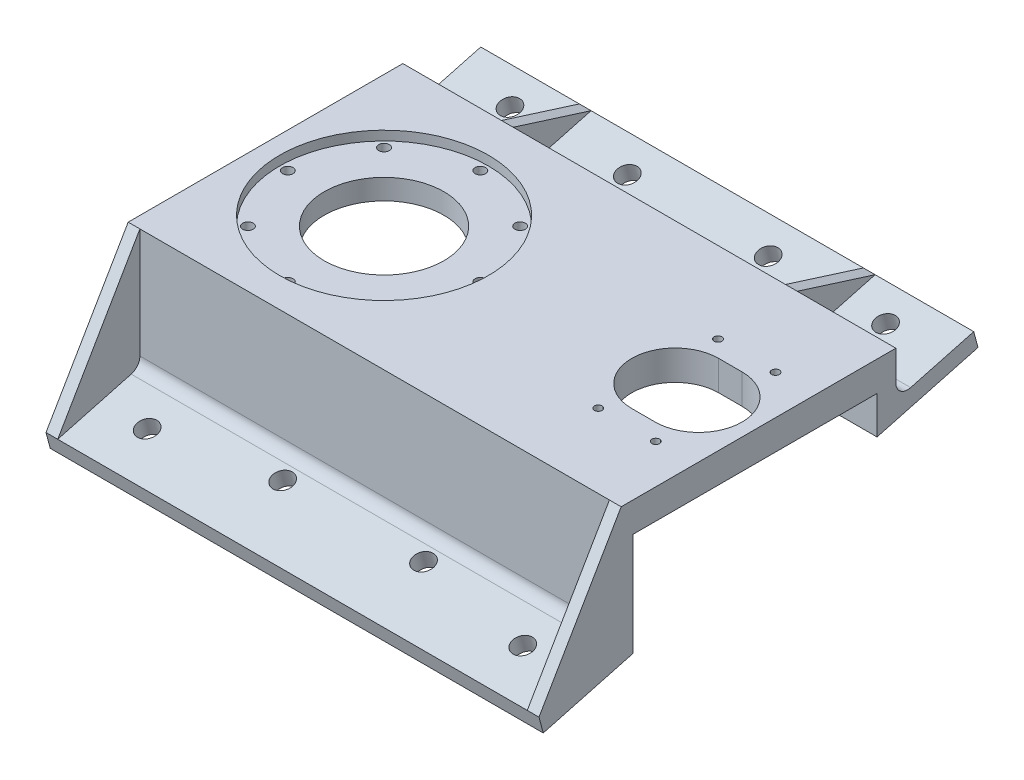
from build123d import *

# Parameters (mm, degrees)
EXTRUDE_1_DEPTH      = 30
SKETCH_2_R           = 44.45
CUT_EXTRUDE_1_DEPTH  = 4
SKETCH_3_R           = 25.5
SKETCH_3_R_2         = 2.25
CUT_EXTRUDE_2_DEPTH  = 188.619295383
CUT_EXTRUDE_3_DEPTH  = 189.215302247
SKETCH_5_R           = 1.65
CUT_EXTRUDE_4_DEPTH  = 189.215302247
EXTRUDE_START        = -30
EXTRUDE_2_DEPTH      = 30
CUT_EXTRUDE_5_DEPTH  = 198.040604952
CUT_EXTRUDE_7_DEPTH  = 233.432785983
CUT_EXTRUDE_8_DEPTH  = 233.432785983
CUT_EXTRUDE_9_DEPTH  = 233.432785983
FILLET_1_R           = 5
CUT_EXTRUDE_10_DEPTH = 233.432785983
EXTRUDE_START_2      = -5
EXTRUDE_3_DEPTH      = 5
EXTRUDE_4_DEPTH      = 5
SKETCH_14_R          = 4.25
CUT_EXTRUDE_11_DEPTH = 189.364728478
SKETCH_16_W          = 43
SKETCH_16_H          = 30
CUT_EXTRUDE_12_DEPTH = 233.432785983
EXTRUDE_7_REACH      = 188.592
SKETCH_18_W          = 210
SKETCH_18_H          = 5
EXTRUDE_8_DEPTH      = 210
EXTRUDE_9_DEPTH      = 5
EXTRUDE_10_DEPTH     = 5
SKETCH_22_R          = 4.25
CUT_EXTRUDE_13_DEPTH = 187.984035343
FILLET_2_R           = 5
EXTRUDE_11_DEPTH     = 2.5
CUT_EXTRUDE_START    = -5
CUT_EXTRUDE_16_DEPTH = 5
EXTRUDE_12_DEPTH     = 2.5
CUT_EXTRUDE_18_DEPTH = 5


with BuildPart() as part:
    # 草图1 → 凸台-拉伸1 (new body)
    with BuildSketch(Plane(origin=(0, 0, 0), x_dir=(1, 0, 0), z_dir=(0, 1, 0))):
        with BuildLine():
            Line((170, 31.93), (170, -31.93))
            ThreePointArc((170, -31.93), (167.781993847, -38.210172909), (162.111885646, -41.704453387))
            Line((162.111885646, -41.704453387), (15.839142344, -73.308400404))
            ThreePointArc((15.839142344, -73.308400404), (-75, 0), (15.839142344, 73.308400404))
            Line((15.839142344, 73.308400404), (162.111885646, 41.704453387))
            ThreePointArc((162.111885646, 41.704453387), (167.781993847, 38.210172909), (170, 31.93))
        make_face()
    extrude(amount=EXTRUDE_1_DEPTH)

    # 草图2 → 切除-拉伸1 (cut)
    with BuildSketch(Plane(origin=(0, 30, 0), x_dir=(1, 0, 0), z_dir=(0, 1, 0))):
        with Locations(Location((0, 0, 0), (0, 0, 270))):
            Circle(SKETCH_2_R)
    extrude(amount=-CUT_EXTRUDE_1_DEPTH, mode=Mode.SUBTRACT)

    # 草图3 → 切除-拉伸2 (cut, through all)
    with BuildSketch(Plane(origin=(0, 26, 0), x_dir=(1, 0, 0), z_dir=(0, 1, 0))):
        with Locations(Location((0, 0, 0), (0, 0, 270))):
            Circle(SKETCH_3_R)
        with Locations(Location((0, 41, 0), (0, 0, 270))):
            Circle(SKETCH_3_R_2)
        with Locations(Location((28.991378029, 28.991378029, 0), (0, 0, 270))):
            Circle(SKETCH_3_R_2)
        with Locations(Location((41, 0, 0), (0, 0, 270))):
            Circle(SKETCH_3_R_2)
        with Locations(Location((28.991378029, -28.991378029, 0), (0, 0, 270))):
            Circle(SKETCH_3_R_2)
        with Locations(Location((0, -41, 0), (0, 0, 270))):
            Circle(SKETCH_3_R_2)
        with Locations(Location((-28.991378029, -28.991378029, 0), (0, 0, 270))):
            Circle(SKETCH_3_R_2)
        with Locations(Location((-41, 0, 0), (0, 0, 270))):
            Circle(SKETCH_3_R_2)
        with Locations(Location((-28.991378029, 28.991378029, 0), (0, 0, 270))):
            Circle(SKETCH_3_R_2)
    extrude(amount=-CUT_EXTRUDE_2_DEPTH, mode=Mode.SUBTRACT)

    # 草图4 → 切除-拉伸3 (cut, through all)
    with BuildSketch(Plane(origin=(0, 30, 0), x_dir=(1, 0, 0), z_dir=(0, 1, 0))):
        with BuildLine():
            Line((124, 18.5), (134, 18.5))
            ThreePointArc((134, 18.5), (152.5, 0), (134, -18.5))
            Line((134, -18.5), (124, -18.5))
            ThreePointArc((124, -18.5), (105.5, 0), (124, 18.5))
        make_face()
    extrude(amount=-CUT_EXTRUDE_3_DEPTH, mode=Mode.SUBTRACT)

    # 草图5 → 切除-拉伸4 (cut, through all)
    with BuildSketch(Plane(origin=(0, 30, 0), x_dir=(1, 0, 0), z_dir=(0, 1, 0))):
        with Locations(Location((116.75, 25.5, 0), (0, 0, 270))):
            Circle(SKETCH_5_R)
        with Locations(Location((141.25, 25.5, 0), (0, 0, 270))):
            Circle(SKETCH_5_R)
        with Locations(Location((141.25, -25.5, 0), (0, 0, 270))):
            Circle(SKETCH_5_R)
        with Locations(Location((116.75, -25.5, 0), (0, 0, 270))):
            Circle(SKETCH_5_R)
    extrude(amount=-CUT_EXTRUDE_4_DEPTH, mode=Mode.SUBTRACT)

    # 草图6 → 凸台-拉伸2 (add)
    with BuildSketch(Plane(origin=(0, 30, 0), x_dir=(1, 0, 0), z_dir=(0, 1, 0)).offset(EXTRUDE_START)):
        with BuildLine():
            Line((158, 95), (-52, 95))
            Line((-52, 95), (-52, 54.046276467))
            ThreePointArc((-52, 54.046276467), (-20.48558667, 72.148047366), (15.839142344, 73.308400404))
            Line((15.839142344, 73.308400404), (158, 42.592874655))
            Line((158, 42.592874655), (158, 95))
        make_face()
        with BuildLine():
            ThreePointArc((15.839142344, -73.308400404), (-20.48558667, -72.148047366), (-52, -54.046276467))
            Line((-52, -54.046276467), (-52, -95))
            Line((-52, -95), (158, -95))
            Line((158, -95), (158, -42.592874655))
            Line((158, -42.592874655), (15.839142344, -73.308400404))
        make_face()
    extrude(amount=EXTRUDE_2_DEPTH)

    # 草图7 → 切除-拉伸5 (cut, through all)
    with BuildSketch(Plane(origin=(0, 30, 0), x_dir=(1, 0, 0), z_dir=(0, 1, 0))):
        with BuildLine():
            Line((-52, 54.046276467), (-52, -54.046276467))
            ThreePointArc((-52, -54.046276467), (-75, 0), (-52, 54.046276467))
        make_face()
        with BuildLine():
            Line((158, 42.592874655), (158, -42.592874655))
            Line((158, -42.592874655), (162.111885646, -41.704453387))
            ThreePointArc((162.111885646, -41.704453387), (167.781993847, -38.210172909), (170, -31.93))
            Line((170, -31.93), (170, 31.93))
            ThreePointArc((170, 31.93), (167.781993847, 38.210172909), (162.111885646, 41.704453387))
            Line((162.111885646, 41.704453387), (158, 42.592874655))
        make_face()
    extrude(amount=-CUT_EXTRUDE_5_DEPTH, mode=Mode.SUBTRACT)

    # 草图9 → 切除-拉伸7 (cut, through all)
    with BuildSketch(Plane.ZY.offset(52)):
        Polygon((-95, 20), (-60, 10.621778265), (-60, 30), (-95, 30), align=None)
    extrude(amount=-CUT_EXTRUDE_7_DEPTH, mode=Mode.SUBTRACT)

    # 草图10 → 切除-拉伸8 (cut, through all)
    with BuildSketch(Plane.ZY.offset(52)):
        Polygon((-95, 12.753066737), (-52, 1.231251463), (-52, 0), (-95, 0), align=None)
    extrude(amount=-CUT_EXTRUDE_8_DEPTH, mode=Mode.SUBTRACT)

    # 草图8 → 切除-拉伸9 (cut, through all)
    with BuildSketch(Plane.ZY.offset(52)):
        Polygon((0, 0), (52, 0), (52, 17.3), (-52, 17.3), (-52, 0), align=None)
    extrude(amount=-CUT_EXTRUDE_9_DEPTH, mode=Mode.SUBTRACT)

    # 圆角1
    fillet_1_edges = [part.edges().sort_by_distance(p)[0] for p in [
        (53, 10.621778265, -60),
    ]]
    fillet(fillet_1_edges, radius=FILLET_1_R)

    # 草图11 → 切除-拉伸10 (cut, through all)
    with BuildSketch(Plane.ZY.offset(52)):
        Polygon((-95, 12.753066737), (-93.188266684, 19.514547521), (-95, 20), align=None)
    extrude(amount=-CUT_EXTRUDE_10_DEPTH, mode=Mode.SUBTRACT)

    # 草图12 → 凸台-拉伸3 (add)
    with BuildSketch(Plane.ZY.offset(52).offset(EXTRUDE_START_2)):
        with BuildLine():
            Line((-93.188266684, 19.514547521), (-60, 30))
            Line((-60, 30), (-60, 17.137905129))
            ThreePointArc((-60, 17.137905129), (-61.956192855, 13.171138428), (-66.294095226, 12.308275998))
            Line((-66.294095226, 12.308275998), (-93.188266684, 19.514547521))
        make_face()
    extrude(amount=EXTRUDE_3_DEPTH)

    # 草图13 → 凸台-拉伸4 (add)
    with BuildSketch(Plane(origin=(158, 0, 0), x_dir=(0, 0, -1), z_dir=(1, 0, 0))):
        with BuildLine():
            Line((66.294095226, 12.308275998), (93.188266684, 19.514547521))
            Line((93.188266684, 19.514547521), (60, 30))
            Line((60, 30), (60, 17.137905129))
            ThreePointArc((60, 17.137905129), (61.956192855, 13.171138428), (66.294095226, 12.308275998))
        make_face()
    extrude(amount=-EXTRUDE_4_DEPTH)

    # 草图14 → 切除-拉伸11 (cut, through all)
    with BuildSketch(Plane(origin=(0, -5.089745962, -1.36379332), x_dir=(1, 0, 0), z_dir=(0, 0.9659258262890681, 0.2588190451025214))):
        with Locations(Location((-27, 82.063690052, 0), (0, 0, 270))):
            Circle(SKETCH_14_R)
        with Locations(Location((23, 82.063690052, 0), (0, 0, 270))):
            Circle(SKETCH_14_R)
        with Locations(Location((83, 82.063690052, 0), (0, 0, 270))):
            Circle(SKETCH_14_R)
        with Locations(Location((133, 82.063690052, 0), (0, 0, 270))):
            Circle(SKETCH_14_R)
    extrude(amount=-CUT_EXTRUDE_11_DEPTH, mode=Mode.SUBTRACT)

    # 草图16 → 切除-拉伸12 (cut, through all)
    with BuildSketch(Plane.ZY.offset(52)):
        with Locations((73.5, 15)):
            Rectangle(SKETCH_16_W, SKETCH_16_H)
    extrude(amount=-CUT_EXTRUDE_12_DEPTH, mode=Mode.SUBTRACT)

    # 凸台-拉伸7: up to this plane
    extrude_7_end = Plane(origin=(0, -11.851226746, -3.175526636), z_dir=(0, -0.9659258262890681, -0.25881904510252146))
    # 草图18 → 凸台-拉伸7 (add, up to the surface)
    with BuildSketch(Plane(origin=(0, 30, 0), x_dir=(1, 0, 0), z_dir=(0, 1, 0)), mode=Mode.PRIVATE) as extrude_7_sk1:
        with Locations((53, -54.5)):
            Rectangle(SKETCH_18_W, SKETCH_18_H)
    extrude_7_tool1 = split(extrude(extrude_7_sk1.sketch, amount=-EXTRUDE_7_REACH, mode=Mode.PRIVATE), bisect_by=extrude_7_end, keep=Keep.BOTH, mode=Mode.PRIVATE)
    add(extrude_7_tool1.solids().sort_by_distance((53, 30, 54.5))[0])

    # 草图19 → 凸台-拉伸8 (add)
    with BuildSketch(Plane.ZY.offset(52)):
        Polygon((57, -27.975210512), (90.188266684, -36.867979769), (92, -30.106498985), (57, -20.72827725), align=None)
    extrude(amount=-EXTRUDE_8_DEPTH)

    # 草图20 → 凸台-拉伸9 (add)
    with BuildSketch(Plane.ZY.offset(52)):
        Polygon((92, -30.106498985), (57, -20.72827725), (57, 30), align=None)
    extrude(amount=-EXTRUDE_9_DEPTH)

    # 草图21 → 凸台-拉伸10 (add)
    with BuildSketch(Plane(origin=(158, 0, 0), x_dir=(0, 0, -1), z_dir=(1, 0, 0))):
        Polygon((-57, 30), (-92, -30.106498985), (-57, -20.72827725), align=None)
    extrude(amount=-EXTRUDE_10_DEPTH)

    # 草图22 → 切除-拉伸13 (cut, through all)
    with BuildSketch(Plane(origin=(0, -5.089745962, -1.36379332), x_dir=(1, 0, 0), z_dir=(0, 0.9659258262890686, 0.25881904510251946))):
        with Locations(Location((-27, -77.936309948, 0), (0, 0, 270))):
            Circle(SKETCH_22_R)
        with Locations(Location((23, -69.936309948, 0), (0, 0, 270))):
            Circle(SKETCH_22_R)
        with Locations(Location((83, -69.936309948, 0), (0, 0, 270))):
            Circle(SKETCH_22_R)
        with Locations(Location((133, -77.936309948, 0), (0, 0, 270))):
            Circle(SKETCH_22_R)
    extrude(amount=-CUT_EXTRUDE_13_DEPTH, mode=Mode.SUBTRACT)

    # 圆角2
    fillet_2_edges = [part.edges().sort_by_distance(p)[0] for p in [
        (53, -20.72827725, 57),
    ]]
    fillet(fillet_2_edges, radius=FILLET_2_R)

    # 草图27 → 凸台-拉伸11 (add, symmetric)
    with BuildSketch(Plane(origin=(113.5, 0, 0), x_dir=(0, 0, -1), z_dir=(1, 0, 0))):
        with BuildLine():
            Line((60, 30), (60, 17.137905129))
            ThreePointArc((60, 17.137905129), (61.956192855, 13.171138428), (66.294095226, 12.308275998))
            Line((66.294095226, 12.308275998), (93.188266684, 19.514547521))
            Line((93.188266684, 19.514547521), (60, 30))
        make_face()
    extrude(amount=EXTRUDE_11_DEPTH, both=True)

    # 草图29 → 切除-拉伸16 (cut)
    with BuildSketch(Plane.ZY.offset(-153).offset(CUT_EXTRUDE_START)):
        with BuildLine():
            Line((-60, 17.137905129), (-60, 30))
            Line((-60, 30), (-93.188266684, 19.514547521))
            Line((-93.188266684, 19.514547521), (-66.294095226, 12.308275998))
            ThreePointArc((-66.294095226, 12.308275998), (-61.956192855, 13.171138428), (-60, 17.137905129))
        make_face()
    extrude(amount=CUT_EXTRUDE_16_DEPTH, mode=Mode.SUBTRACT)

    # 草图30 → 凸台-拉伸12 (add, symmetric)
    with BuildSketch(Plane.ZY.offset(7.5)):
        with BuildLine():
            Line((-93.188266684, 19.514547521), (-66.294095226, 12.308275998))
            ThreePointArc((-66.294095226, 12.308275998), (-61.956192855, 13.171138428), (-60, 17.137905129))
            Line((-60, 17.137905129), (-60, 30))
            Line((-60, 30), (-93.188266684, 19.514547521))
        make_face()
    extrude(amount=EXTRUDE_12_DEPTH, both=True)

    # 草图31 → 切除-拉伸18 (cut)
    with BuildSketch(Plane(origin=(-47, 0, 0), x_dir=(0, 0, -1), z_dir=(1, 0, 0))):
        with BuildLine():
            Line((66.294095226, 12.308275998), (93.188266684, 19.514547521))
            Line((93.188266684, 19.514547521), (60, 30))
            Line((60, 30), (60, 17.137905129))
            ThreePointArc((60, 17.137905129), (61.956192855, 13.171138428), (66.294095226, 12.308275998))
        make_face()
    extrude(amount=-CUT_EXTRUDE_18_DEPTH, mode=Mode.SUBTRACT)


solid = part.part
